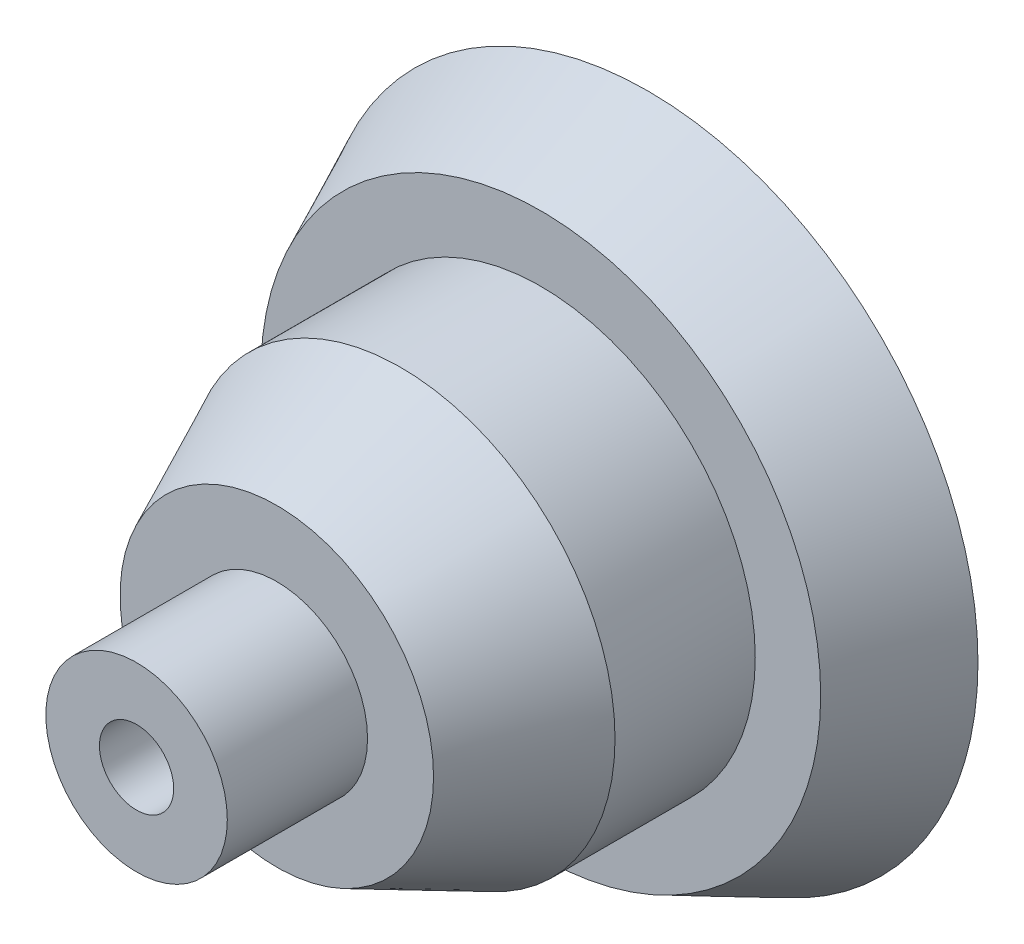
from build123d import *


with BuildPart() as part:
    # Sketch1 → Revolve1 (revolve)
    with BuildSketch(Plane(origin=(0, 0, 0), x_dir=(0, 0, -1), z_dir=(1, 0, 0)), mode=Mode.PRIVATE) as revolve1_sk:
        Polygon((-38.5, 4.5), (-38.5, 11), (-21.5, 11), (-21.5, 19), (-6.5, 26), (10.5, 26), (10.5, 33.932474964), (23.5, 40), (23.5, 4.5), (16.5, 4.5), (16.5, 11), (-16.5, 11), (-16.5, 4.5), align=None)
    revolve(revolve1_sk.sketch.rotate(Axis((0, 0, 50), (0, 0, -1)), 90), axis=Axis((0, 0, 50), (0, 0, -1)))


solid = part.part
